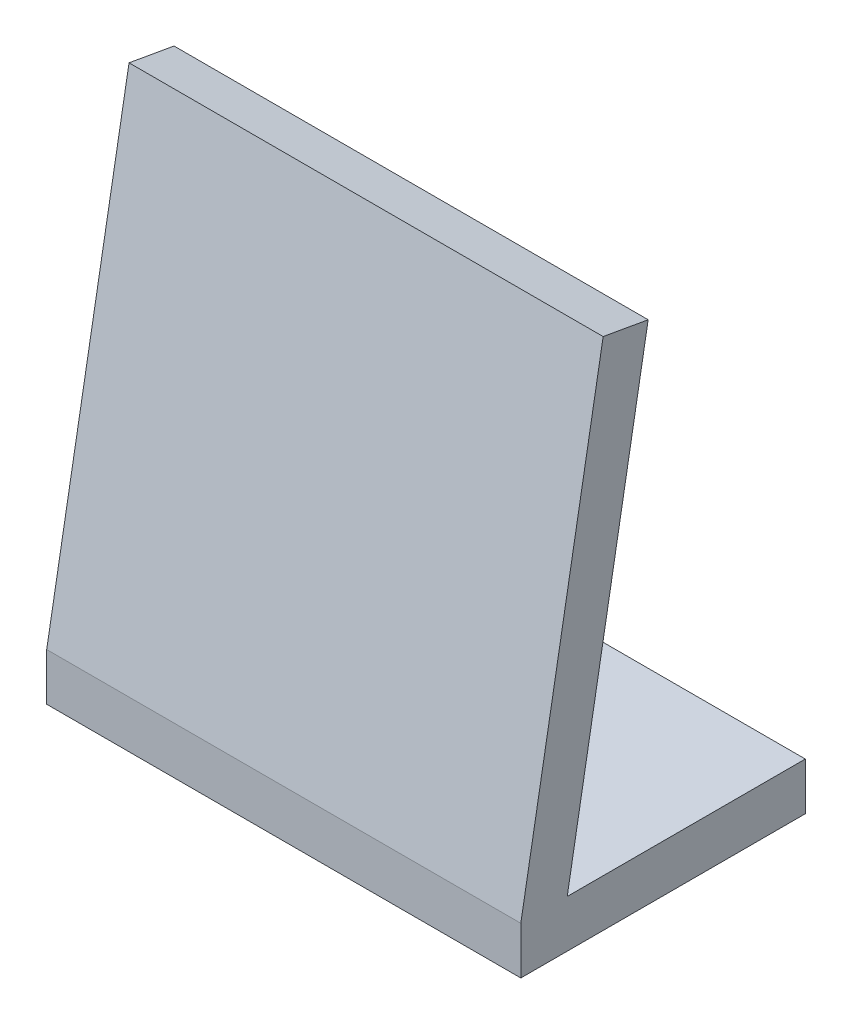
from build123d import *

# Parameters (mm, degrees)
SKETCH1_W           = 25
SKETCH1_H           = 15
BOSS_EXTRUDE1_DEPTH = 2.5
BOSS_EXTRUDE2_DEPTH = 25


with BuildPart() as part:
    # Sketch1 → Boss-Extrude1 (new body)
    with BuildSketch(Plane(origin=(0, 0, 0), x_dir=(1, 0, 0), z_dir=(0, 1, 0))):
        Rectangle(SKETCH1_W, SKETCH1_H)
    extrude(amount=BOSS_EXTRUDE1_DEPTH)

    # Sketch2 → Boss-Extrude2 (add, through all)
    with BuildSketch(Plane.ZY.offset(12.5)):
        Polygon((0.785626796, 26.701740143), (3.158795558, 27.120193825), (7.5, 2.5), (5.126831238, 2.081546317), align=None)
    extrude(amount=-BOSS_EXTRUDE2_DEPTH)


solid = part.part
